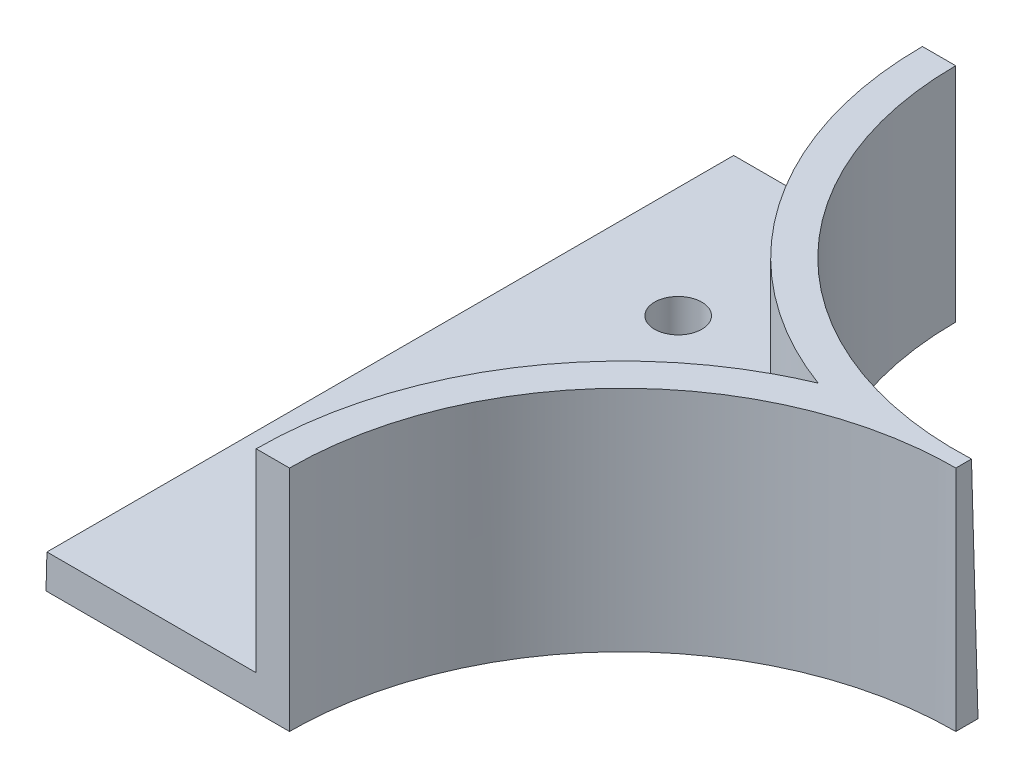
from build123d import *

# Parameters (mm, degrees)
SKETCH_1_W               = 50
SKETCH_1_H               = 60
EXTRUDE_1_DEPTH          = 70
DRAFT_1_ANGLE            = 1.591
CUT_EXTRUDE_1_DEPTH      = 72
CUT_EXTRUDE_1_DEPTH_BACK = 2
SKETCH_3_R               = 30
SKETCH_4_R               = 30
CUT_EXTRUDE_2_DEPTH      = 70
SKETCH_5_W               = 61.388766385
SKETCH_5_H               = 50
CUT_EXTRUDE_3_DEPTH      = 93.836652759
SHELL_1_T                = -3
SKETCH_6_R               = 2.125
CUT_EXTRUDE_4_DEPTH      = 64.305956024


with BuildPart() as part:
    # 草圖1 → 填料-伸長1 (new body)
    with BuildSketch(Plane(origin=(0, 0, 0), x_dir=(1, 0, 0), z_dir=(0, 1, 0))):
        with Locations((25, 0)):
            Rectangle(SKETCH_1_W, SKETCH_1_H)
    extrude(amount=EXTRUDE_1_DEPTH)

    # 拔模1
    draft_1_faces = [part.faces().sort_by_distance(p)[0] for p in [
        (50, 35, 0),
        (25, 35, 30),
    ]]
    draft(draft_1_faces, Plane.ZX.offset(70), DRAFT_1_ANGLE)

    # 草圖3 → 除料-伸長1 (cut, two sides: drawn at the far end of the back side and taken through both)
    with BuildSketch(Plane(origin=(50, 70, 30), x_dir=(0.9996147856379402, 0.02774322520612563, -0.0007705771714084017), z_dir=(0.02775392465967472, -0.9992294227713525, 0.027753924659674706)).offset(-CUT_EXTRUDE_1_DEPTH_BACK)):
        Circle(SKETCH_3_R)
    extrude(amount=CUT_EXTRUDE_1_DEPTH + CUT_EXTRUDE_1_DEPTH_BACK, mode=Mode.SUBTRACT)

    # 草圖4 → 除料-伸長2 (cut)
    with BuildSketch(Plane(origin=(0, 70, 0), x_dir=(1, 0, 0), z_dir=(0, 1, 0))):
        with Locations((50, 30)):
            Circle(SKETCH_4_R)
    extrude(amount=-CUT_EXTRUDE_2_DEPTH, mode=Mode.SUBTRACT)

    # 草圖5 → 除料-伸長3 (cut, through all)
    with BuildSketch(Plane.ZY):
        with Locations((0.694383192, 45)):
            Rectangle(SKETCH_5_W, SKETCH_5_H)
    extrude(amount=-CUT_EXTRUDE_3_DEPTH, mode=Mode.SUBTRACT)

    # 薄殼1
    shell_1_openings = [part.faces().sort_by_distance(p)[0] for p in [
        (14.866961876, 20, 1.073459526),
        (10, 10, -30),
        (10.828073147, 9.957245624, 31.667707178),
        (0, 9.984986274, 0.833468336),
    ]]
    offset(amount=SHELL_1_T, openings=shell_1_openings, kind=Kind.INTERSECTION)

    # 草圖6 → 除料-伸長4 (cut, through all)
    with BuildSketch(Plane(origin=(0, 3, 0), x_dir=(1, 0, 0), z_dir=(0, 1, 0))):
        with Locations(Location((10, 15, 0), (0, 0, 270))):
            Circle(SKETCH_6_R)
        with Locations(Location((10, -15, 0), (0, 0, 90))):
            Circle(SKETCH_6_R)
    extrude(amount=-CUT_EXTRUDE_4_DEPTH, mode=Mode.SUBTRACT)


solid = part.part
